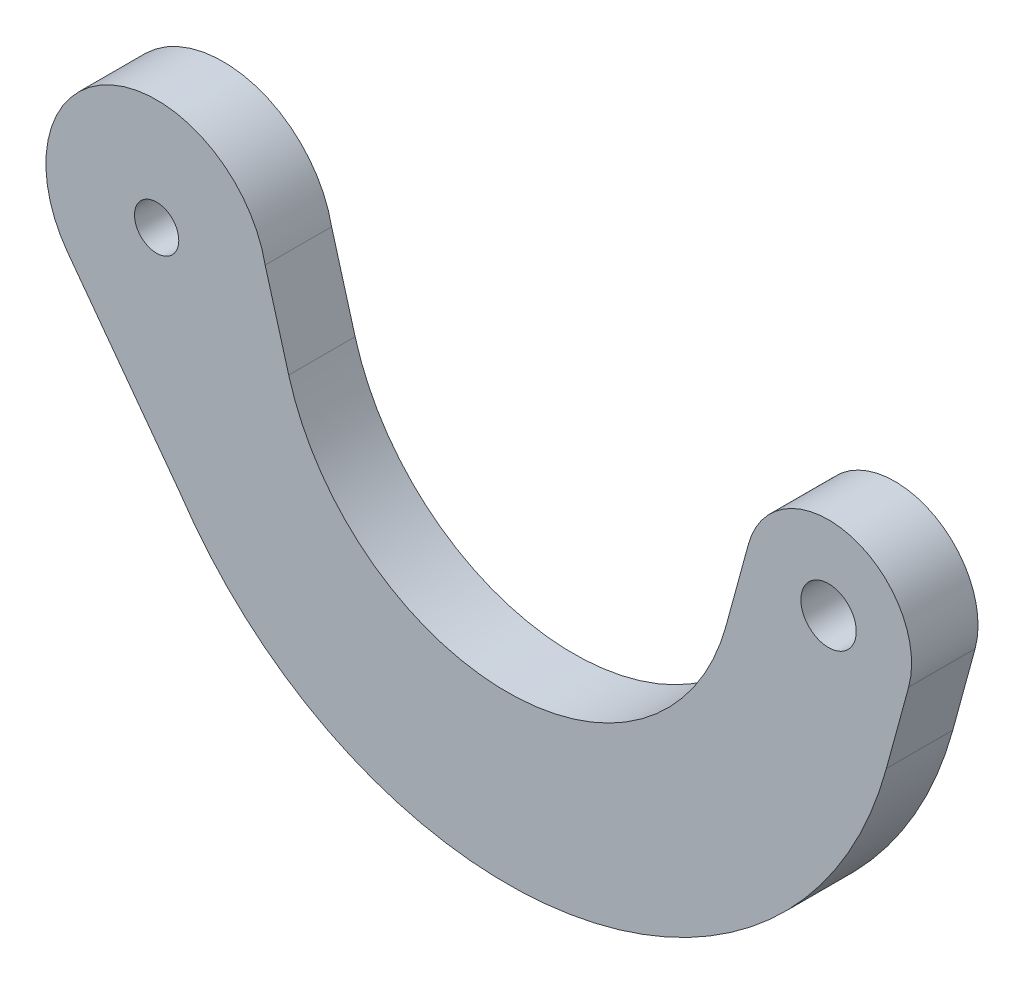
from build123d import *

# Parameters (mm, degrees)
SKETCH1_R           = 2
SKETCH1_R_2         = 2.5
BOSS_EXTRUDE1_DEPTH = 6


with BuildPart() as part:
    # Sketch1 → Boss-Extrude1 (new body)
    with BuildSketch(Plane.XY):
        with BuildLine():
            Line((53.447684375, 1.974894379), (51.435225406, -5.398044637))
            ThreePointArc((51.435225406, -5.398044637), (31.743794042, -20.499823373), (11.927663731, -5.562046775))
            Line((11.927663731, -5.562046775), (9.803050147, 1.974894379))
            ThreePointArc((9.803050147, 1.974894379), (-4.056641299, 9.140222173), (-8.041130375, -5.944764276))
            Line((-8.041130375, -5.944764276), (2.110775064, -19.676645204))
            ThreePointArc((2.110775064, -19.676645204), (37.332477988, -35.043661314), (65.905856656, -9.347833395))
            Line((65.905856656, -9.347833395), (67.918315625, -1.974894379))
            ThreePointArc((67.918315625, -1.974894379), (62.657894379, 7.235315625), (53.447684375, 1.974894379))
        make_face()
        Circle(SKETCH1_R, mode=Mode.SUBTRACT)
        with Locations((60.683, 0)):
            Circle(SKETCH1_R_2, mode=Mode.SUBTRACT)
    extrude(amount=BOSS_EXTRUDE1_DEPTH)


solid = part.part
